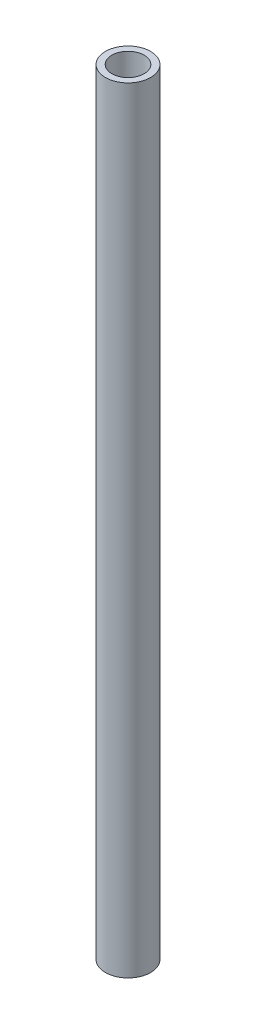
from build123d import *

# Parameters (mm, degrees)
SKETCH1_W = 1
SKETCH1_H = 120


with BuildPart() as part:
    # Sketch1 → Revolve1 (revolve)
    with BuildSketch(Plane.XY, mode=Mode.PRIVATE) as revolve1_sk:
        with Locations((3, 0)):
            Rectangle(SKETCH1_W, SKETCH1_H)
    revolve(revolve1_sk.sketch.rotate(Axis((0, -84.586466165, 0), (0, 1, 0)), 90), axis=Axis((0, -84.586466165, 0), (0, 1, 0)))


solid = part.part
